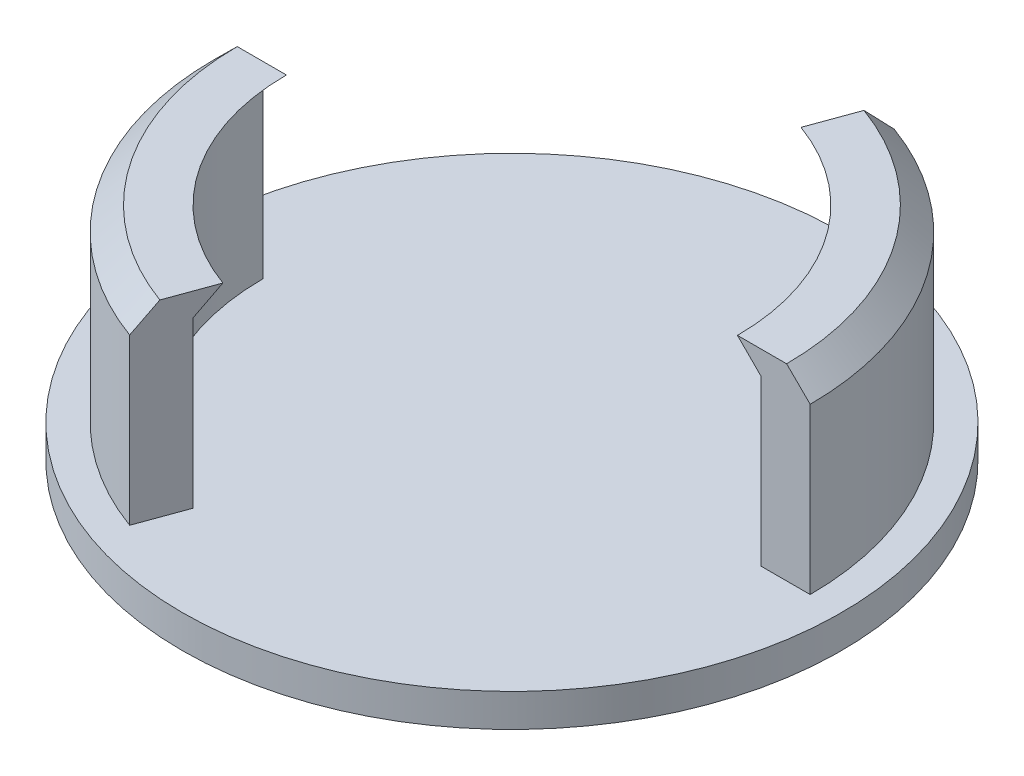
from build123d import *

# Parameters (mm, degrees)
SKETCH1_R           = 20
BOSS_EXTRUDE1_DEPTH = 2
REVOLVE1_ANGLE      = 70


with BuildPart() as part:
    # Sketch1 → Boss-Extrude1 (new body)
    with BuildSketch(Plane(origin=(0, 0, 0), x_dir=(1, 0, 0), z_dir=(0, 1, 0))):
        with Locations(Location((0, 0, 0), (0, 0, 270))):
            Circle(SKETCH1_R)
    extrude(amount=BOSS_EXTRUDE1_DEPTH)

    # Sketch2 → Revolve1 (revolve)
    with BuildSketch(Plane.XY):
        Polygon((18.1, 12), (16.669921141, 13.414213562), (13.685786438, 13.414213562), (15.1, 12), (15.1, 2), (18.1, 2), align=None)
        Polygon((-15.1, 2), (-15.1, 12), (-13.685786438, 13.414213562), (-16.669921141, 13.414213562), (-18.1, 12), (-18.1, 2), align=None)
    revolve(axis=Axis((0, 0, 0), (0, 1, 0)), revolution_arc=REVOLVE1_ANGLE)


solid = part.part
